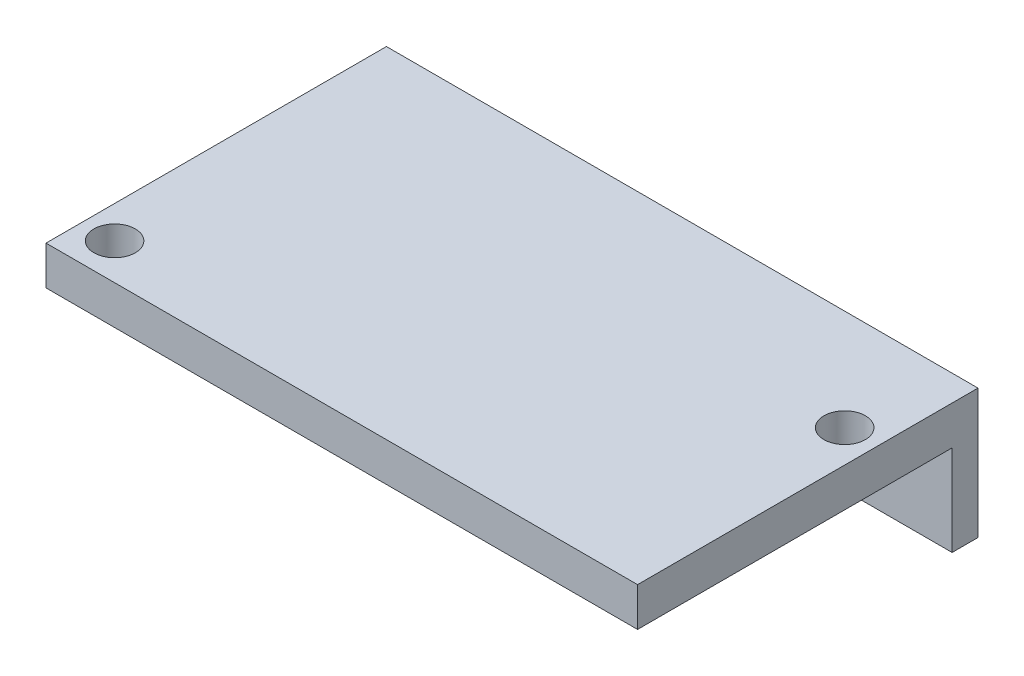
from build123d import *

# Parameters (mm, degrees)
IZIM1_W                     = 45.7
IZIM1_H                     = 24.3
Y_KSEKLIK_EKSTR_ZYON1_DEPTH = 3
IZIM2_R                     = 1.6
KES_EKSTR_ZYON1_DEPTH       = 21.8
IZIM4_W                     = 45.7
IZIM4_H                     = 2
Y_KSEKLIK_EKSTR_ZYON2_DEPTH = 10
IZIM5_R                     = 1.6
KES_EKSTR_ZYON2_DEPTH       = 4


with BuildPart() as part:
    # Çizim1 → Yükseklik-Ekstrüzyon1 (new body)
    with BuildSketch(Plane(origin=(0, 0, 0), x_dir=(1, 0, 0), z_dir=(0, 1, 0))):
        Rectangle(IZIM1_W, IZIM1_H)
    extrude(amount=Y_KSEKLIK_EKSTR_ZYON1_DEPTH)

    # Çizim2 → Kes-Ekstrüzyon1 (cut)
    with BuildSketch(Plane(origin=(0, 3, 0), x_dir=(1, 0, 0), z_dir=(0, 1, 0))):
        with Locations(Location((-20.35, -9.35, 0), (0, 0, 270))):
            Circle(IZIM2_R)
        with Locations(Location((20.35, 6.35, 0), (0, 0, 270))):
            Circle(IZIM2_R)
    extrude(amount=-KES_EKSTR_ZYON1_DEPTH, mode=Mode.SUBTRACT)

    # Çizim4 → Yükseklik-Ekstrüzyon2 (add)
    with BuildSketch(Plane(origin=(0, 3, 0), x_dir=(1, 0, 0), z_dir=(0, 1, 0))):
        with Locations((0, 13.15)):
            Rectangle(IZIM4_W, IZIM4_H)
    extrude(amount=-Y_KSEKLIK_EKSTR_ZYON2_DEPTH)

    # Çizim5 → Kes-Ekstrüzyon2 (cut)
    with BuildSketch(Plane(origin=(0, 0, -14.15), x_dir=(-1, 0, 0), z_dir=(0, 0, -1))):
        with Locations((-12.85, -4)):
            Circle(IZIM5_R)
        with Locations((12.85, -4)):
            Circle(IZIM5_R)
    extrude(amount=-KES_EKSTR_ZYON2_DEPTH, mode=Mode.SUBTRACT)


solid = part.part
